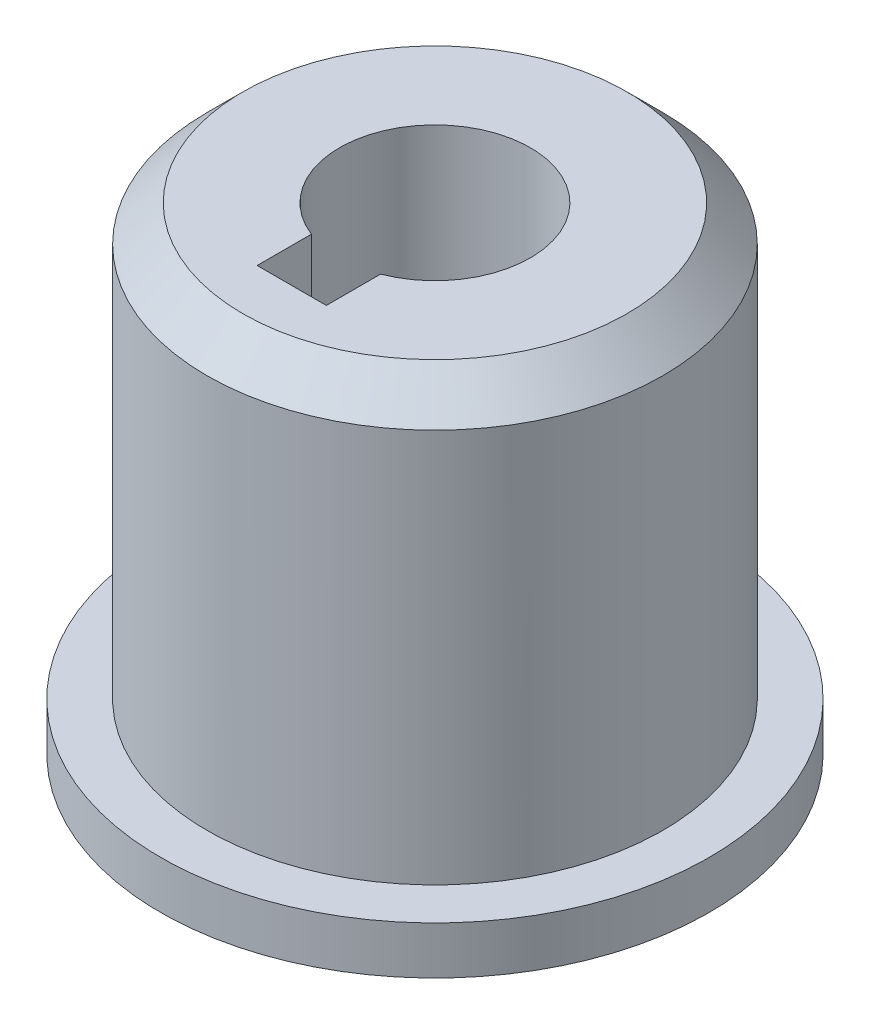
from build123d import *

# Parameters (mm, degrees)
SKETCH1_R           = 9.55
BOSS_EXTRUDE1_DEPTH = 20
CHAMFER1_SIZE       = 1.5
SKETCH2_R           = 11.5
SKETCH2_R_2         = 9.55
BOSS_EXTRUDE2_DEPTH = 2


with BuildPart() as part:
    # Sketch1 → Boss-Extrude1 (new body)
    with BuildSketch(Plane(origin=(0, 0, 0), x_dir=(1, 0, 0), z_dir=(0, 1, 0))):
        with Locations(Location((0, 0, 0), (0, 0, 270))):
            Circle(SKETCH1_R)
        with BuildLine():
            Line((-1.45, -6), (1.45, -6))
            Line((1.45, -6), (1.45, -3.727935085))
            ThreePointArc((1.45, -3.727935085), (0, 4), (-1.45, -3.727935085))
            Line((-1.45, -3.727935085), (-1.45, -6))
        make_face(mode=Mode.SUBTRACT)
    extrude(amount=BOSS_EXTRUDE1_DEPTH)

    # Chamfer1
    chamfer1_edges = [part.edges().sort_by_distance(p)[0] for p in [
        (0, 20, -9.55),
    ]]
    chamfer(chamfer1_edges, length=CHAMFER1_SIZE)

    # Sketch2 → Boss-Extrude2 (add)
    with BuildSketch(Plane.XZ):
        with Locations(Location((0, 0, 0), (0, 0, 270))):
            Circle(SKETCH2_R)
        with Locations(Location((0, 0, 0), (0, 0, 270))):
            Circle(SKETCH2_R_2, mode=Mode.SUBTRACT)
    extrude(amount=-BOSS_EXTRUDE2_DEPTH)


solid = part.part
